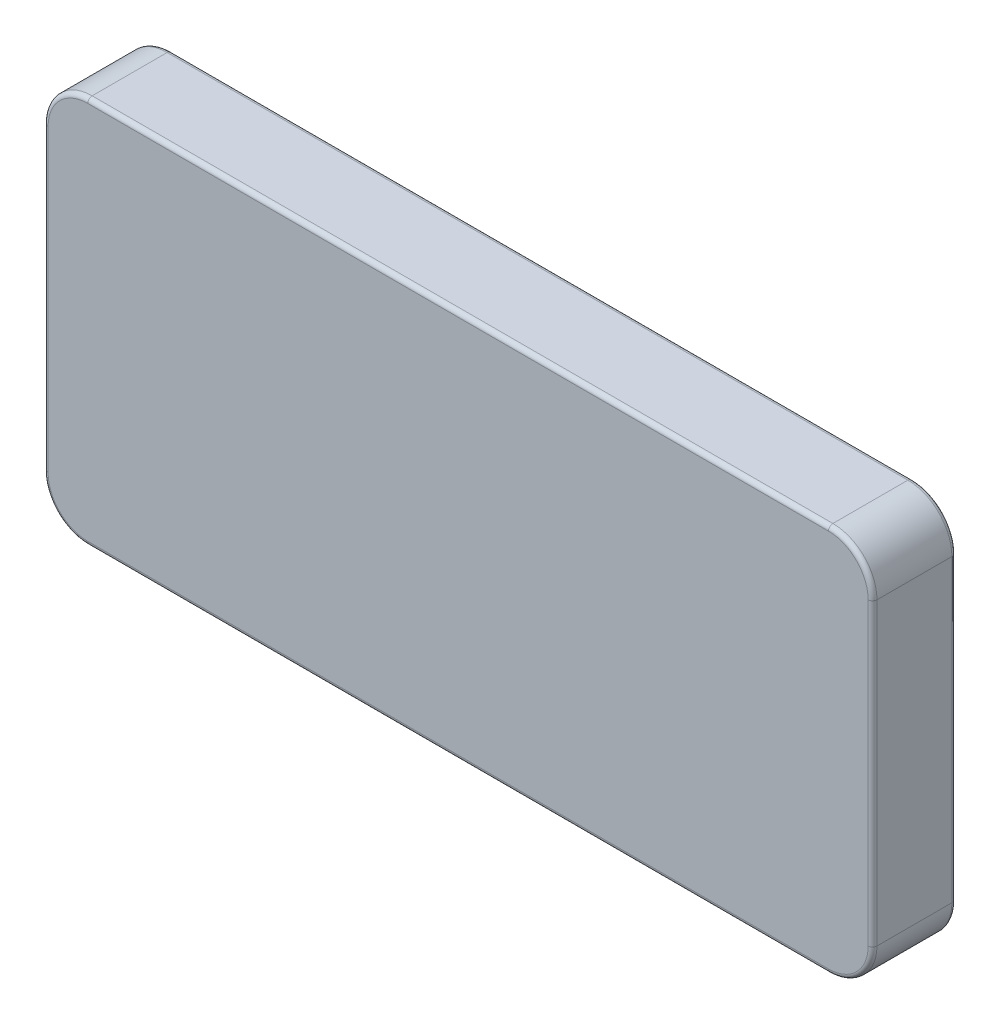
from build123d import *

# Parameters (mm, degrees)
ESQUISSE1_W        = 1880
ESQUISSE1_H        = 880
BOSS_EXTRU_1_DEPTH = 190
CONG_1_R           = 100
CONG_2_R           = 10


with BuildPart() as part:
    # Esquisse1 → Boss.-Extru.1 (new body)
    with BuildSketch(Plane.XY):
        with Locations((940, 440)):
            Rectangle(ESQUISSE1_W, ESQUISSE1_H)
    extrude(amount=BOSS_EXTRU_1_DEPTH)

    # Congé1
    cong_1_edges = [part.edges().sort_by_distance(p)[0] for p in [
        (0, 880, 95),
        (1880, 880, 95),
        (1880, 0, 95),
        (0, 0, 95),
    ]]
    fillet(cong_1_edges, radius=CONG_1_R)

    # Congé2
    cong_2_edges = [part.edges().sort_by_distance(p)[0] for p in [
        (0, 440, 0),
        (0, 440, 190),
        (940, 880, 0),
        (1880, 440, 0),
        (940, 0, 0),
        (1850.710678119, 850.710678119, 0),
        (1850.710678119, 29.289321881, 0),
        (29.289321881, 29.289321881, 0),
        (29.289321881, 850.710678119, 0),
        (940, 880, 190),
        (940, 0, 190),
        (1880, 440, 190),
        (1850.710678119, 850.710678119, 190),
        (1850.710678119, 29.289321881, 190),
        (29.289321881, 29.289321881, 190),
        (29.289321881, 850.710678119, 190),
    ]]
    fillet(cong_2_edges, radius=CONG_2_R)


solid = part.part
